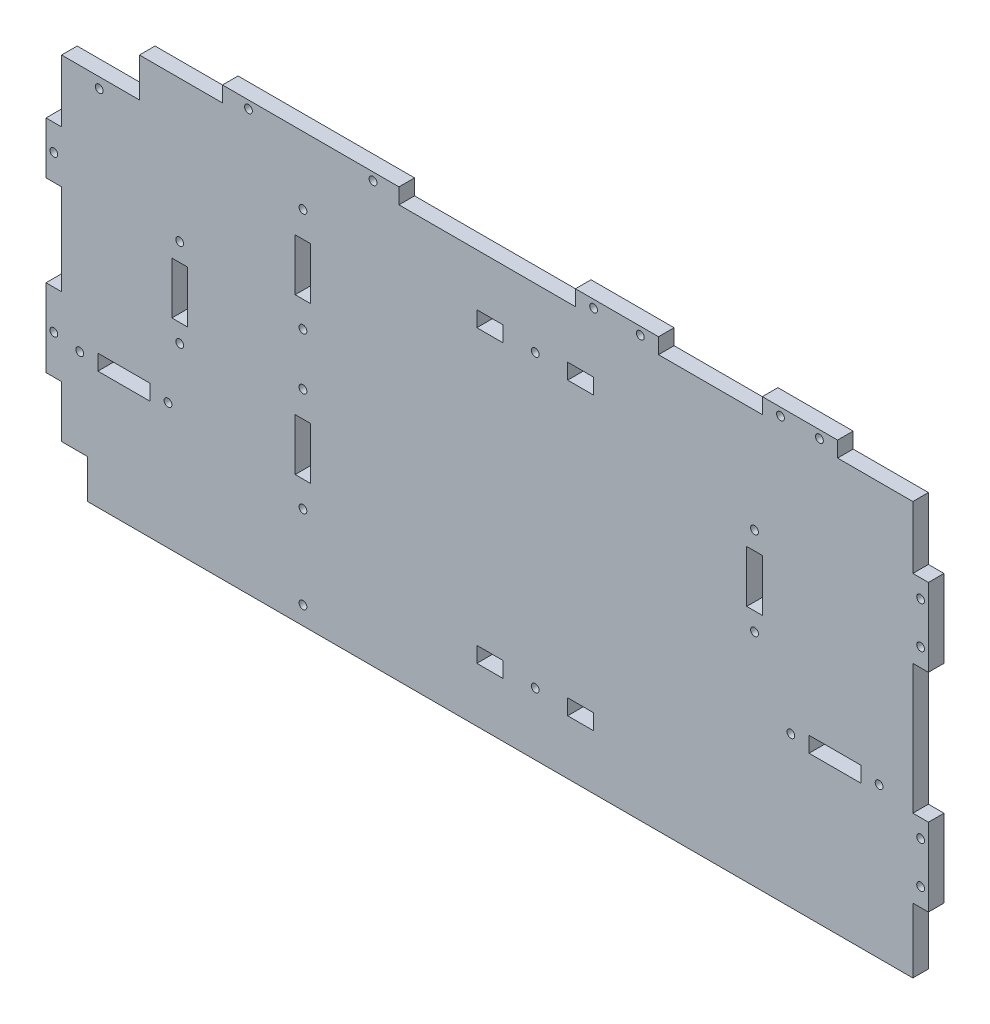
from build123d import *

# Parameters (mm, degrees)
ESQUISSE1_W             = 340
ESQUISSE1_H             = 165
BOSS_EXTRU_1_DEPTH      = 6
ESQUISSE2_W             = 6
ESQUISSE2_H             = 35
ESQUISSE2_H_2           = 20
ESQUISSE2_W_2           = 68
ESQUISSE2_H_3           = 6
ESQUISSE2_H_4           = 25
ESQUISSE2_W_3           = 40
ESQUISSE2_H_5           = 50
ESQUISSE2_W_4           = 20
ENL_V_MAT_EXTRU_1_DEPTH = 6
ESQUISSE3_W             = 6
ESQUISSE3_H             = 20
ESQUISSE3_W_2           = 20
ESQUISSE3_H_2           = 6
ESQUISSE3_W_3           = 30
ESQUISSE3_H_3           = 15
ENL_V_MAT_EXTRU_2_DEPTH = 10
ESQUISSE5_R             = 1.5
ESQUISSE5_W             = 10
ESQUISSE5_H             = 6
ENL_V_MAT_EXTRU_4_DEPTH = 6
ESQUISSE7_R             = 1.5
ESQUISSE7_R_2           = 1.505
ESQUISSE7_W             = 10
ESQUISSE7_H             = 15
ENL_V_MAT_EXTRU_7_DEPTH = 378.969575495
ESQUISSE8_R             = 2.995
ESQUISSE8_R_2           = 3
ENL_V_MAT_EXTRU_9_DEPTH = 3


with BuildPart() as part:
    # Esquisse1 → Boss.-Extru.1 (new body)
    with BuildSketch(Plane.XY):
        with Locations((-170, 82.5)):
            Rectangle(ESQUISSE1_W, ESQUISSE1_H)
    extrude(amount=BOSS_EXTRU_1_DEPTH)

    # Esquisse2 → Enlèv. mat.-Extru.1 (cut)
    with BuildSketch(Plane.XY.offset(6)):
        Polygon((0, 165), (0, 135), (-6, 135), (-6, 159), (-35, 159), (-35, 165), align=None)
        Polygon((-340, 165), (-272, 165), (-272, 159), (-334, 159), (-334, 120), (-340, 120), align=None)
        with Locations((-337, 82.5)):
            Rectangle(ESQUISSE2_W, ESQUISSE2_H)
        with Locations((-67, 102)):
            Rectangle(ESQUISSE2_W, ESQUISSE2_H_2)
        with Locations((-170, 162)):
            Rectangle(ESQUISSE2_W_2, ESQUISSE2_H_3)
        with Locations((-3, 12.5)):
            Rectangle(ESQUISSE2_W, ESQUISSE2_H_4)
        with Locations((-337, 17.5)):
            Rectangle(ESQUISSE2_W, ESQUISSE2_H)
        with Locations((-84, 162)):
            Rectangle(ESQUISSE2_W_3, ESQUISSE2_H_3)
        with Locations((-3, 80)):
            Rectangle(ESQUISSE2_W, ESQUISSE2_H_5)
        with Locations((-36, 58)):
            Rectangle(ESQUISSE2_W_4, ESQUISSE2_H_3)
    extrude(amount=-ENL_V_MAT_EXTRU_1_DEPTH, mode=Mode.SUBTRACT)

    # Esquisse3 → Enlèv. mat.-Extru.2 (cut)
    with BuildSketch(Plane(origin=(0, 0, 0), x_dir=(-1, 0, 0), z_dir=(0, 0, -1))):
        with Locations((241, 119)):
            Rectangle(ESQUISSE3_W, ESQUISSE3_H)
        with Locations((241, 59)):
            Rectangle(ESQUISSE3_W, ESQUISSE3_H)
        with Locations((288.5, 87.5)):
            Rectangle(ESQUISSE3_W, ESQUISSE3_H)
        with Locations((310, 48.5)):
            Rectangle(ESQUISSE3_W_2, ESQUISSE3_H_2)
        with Locations((319, 151.5)):
            Rectangle(ESQUISSE3_W_3, ESQUISSE3_H_3)
    extrude(amount=-ENL_V_MAT_EXTRU_2_DEPTH, mode=Mode.SUBTRACT)

    # Esquisse5 → Enlèv. mat.-Extru.4 (cut)
    with BuildSketch(Plane(origin=(0, 0, 0), x_dir=(-1, 0, 0), z_dir=(0, 0, -1))):
        with Locations((151.5, 136)):
            Circle(ESQUISSE5_R)
        with Locations((151.5, 24)):
            Circle(ESQUISSE5_R)
        with Locations((134, 136)):
            Rectangle(ESQUISSE5_W, ESQUISSE5_H)
        with Locations((169, 136)):
            Rectangle(ESQUISSE5_W, ESQUISSE5_H)
        with Locations((134, 24)):
            Rectangle(ESQUISSE5_W, ESQUISSE5_H)
        with Locations((169, 24)):
            Rectangle(ESQUISSE5_W, ESQUISSE5_H)
    extrude(amount=-ENL_V_MAT_EXTRU_4_DEPTH, mode=Mode.SUBTRACT)

    # Esquisse7 → Enlèv. mat.-Extru.7 (cut, through all)
    with BuildSketch(Plane(origin=(0, 0, 0), x_dir=(-1, 0, 0), z_dir=(0, 0, -1))):
        with Locations((337, 50)):
            Circle(ESQUISSE7_R)
        with Locations((319.5, 140)):
            Circle(ESQUISSE7_R)
        with Locations((42, 162)):
            Circle(ESQUISSE7_R)
        with Locations((293, 48.5)):
            Circle(ESQUISSE7_R)
        with Locations((327, 48.5)):
            Circle(ESQUISSE7_R)
        with Locations((288.5, 70.5)):
            Circle(ESQUISSE7_R)
        with Locations((288.5, 104.5)):
            Circle(ESQUISSE7_R)
        with Locations((241, 39)):
            Circle(ESQUISSE7_R)
        with Locations((241, 79)):
            Circle(ESQUISSE7_R)
        with Locations((241, 99)):
            Circle(ESQUISSE7_R)
        with Locations((241, 139)):
            Circle(ESQUISSE7_R)
        with Locations((241, 7)):
            Circle(ESQUISSE7_R)
        with Locations((57, 162)):
            Circle(ESQUISSE7_R)
        with Locations((262, 162)):
            Circle(ESQUISSE7_R)
        with Locations((214, 162)):
            Circle(ESQUISSE7_R)
        with Locations((111, 162)):
            Circle(ESQUISSE7_R)
        with Locations((138, 162)):
            Circle(ESQUISSE7_R)
        with Locations((129, 162)):
            Circle(ESQUISSE7_R)
        with Locations((67, 85)):
            Circle(ESQUISSE7_R)
        with Locations((67, 119)):
            Circle(ESQUISSE7_R)
        with Locations((53, 58)):
            Circle(ESQUISSE7_R)
        with Locations((19, 58)):
            Circle(ESQUISSE7_R)
        with Locations((3, 32)):
            Circle(ESQUISSE7_R_2)
        with Locations((3, 48)):
            Circle(ESQUISSE7_R)
        with Locations((3, 112)):
            Circle(ESQUISSE7_R)
        with Locations((3, 128)):
            Circle(ESQUISSE7_R)
        with Locations((337, 110)):
            Circle(ESQUISSE7_R)
        with Locations((329, 7.5)):
            Rectangle(ESQUISSE7_W, ESQUISSE7_H)
    extrude(amount=-ENL_V_MAT_EXTRU_7_DEPTH, mode=Mode.SUBTRACT)

    # Esquisse8 → Enlèv. mat.-Extru.9 (cut)
    with BuildSketch(Plane(origin=(0, 0, 0), x_dir=(-1, 0, 0), z_dir=(0, 0, -1))):
        with Locations((3, 32)):
            Circle(ESQUISSE8_R)
        with Locations((3, 48)):
            Circle(ESQUISSE8_R)
        with Locations((19, 58)):
            Circle(ESQUISSE8_R_2)
        with Locations((3, 112)):
            Circle(ESQUISSE8_R)
        with Locations((3, 128)):
            Circle(ESQUISSE8_R)
        with Locations((53, 58)):
            Circle(ESQUISSE8_R_2)
        with Locations((67, 85)):
            Circle(ESQUISSE8_R_2)
        with Locations((67, 119)):
            Circle(ESQUISSE8_R_2)
        with Locations((111, 162)):
            Circle(ESQUISSE8_R)
        with Locations((42, 162)):
            Circle(ESQUISSE8_R)
        with Locations((129, 162)):
            Circle(ESQUISSE8_R)
        with Locations((151.5, 136)):
            Circle(ESQUISSE8_R_2)
        with Locations((151.5, 24)):
            Circle(ESQUISSE8_R_2)
        with Locations((214, 162)):
            Circle(ESQUISSE8_R)
        with Locations((57, 162)):
            Circle(ESQUISSE8_R)
        with Locations((262, 162)):
            Circle(ESQUISSE8_R)
        with Locations((241, 139)):
            Circle(ESQUISSE8_R_2)
        with Locations((241, 99)):
            Circle(ESQUISSE8_R_2)
        with Locations((241, 79)):
            Circle(ESQUISSE8_R_2)
        with Locations((241, 39)):
            Circle(ESQUISSE8_R_2)
        with Locations((241, 7)):
            Circle(ESQUISSE8_R_2)
        with Locations((337, 50)):
            Circle(ESQUISSE8_R)
        with Locations((327, 48.5)):
            Circle(ESQUISSE8_R_2)
        with Locations((293, 48.5)):
            Circle(ESQUISSE8_R_2)
        with Locations((288.5, 70.5)):
            Circle(ESQUISSE8_R_2)
        with Locations((288.5, 104.5)):
            Circle(ESQUISSE8_R_2)
        with Locations((319.5, 140)):
            Circle(ESQUISSE8_R)
        with Locations((337, 110)):
            Circle(ESQUISSE8_R)
    extrude(amount=-ENL_V_MAT_EXTRU_9_DEPTH, mode=Mode.SUBTRACT)


solid = part.part
